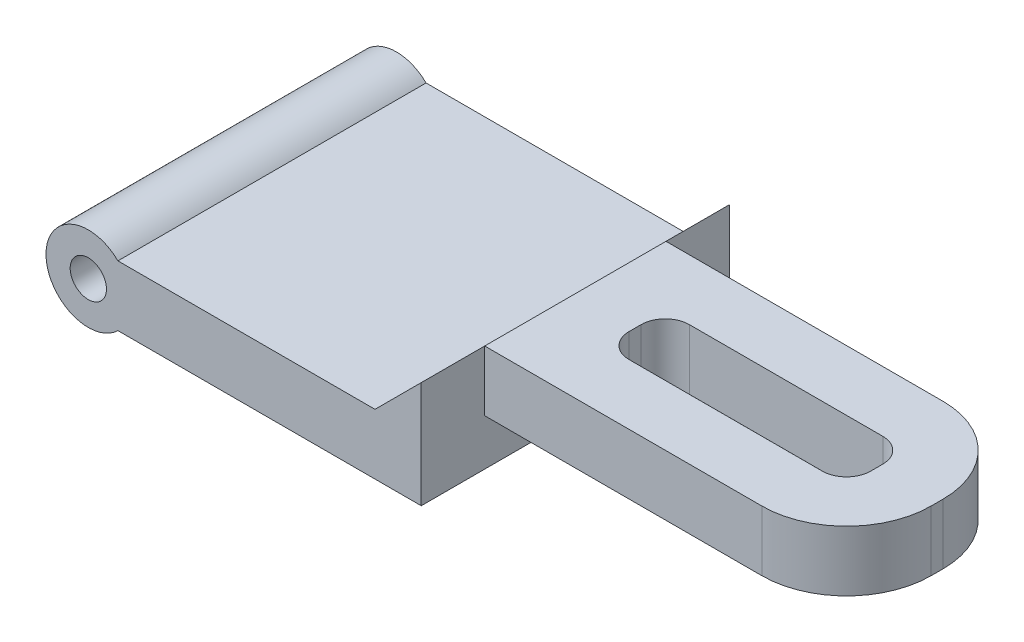
from build123d import *

# Parameters (mm, degrees)
CROQUIS1_W              = 30
CROQUIS1_H              = 25.5
SALIENTE_EXTRUIR1_DEPTH = 5
SALIENTE_EXTRUIR2_DEPTH = 25.5
CROQUIS3_R              = 3.5
SALIENTE_EXTRUIR3_DEPTH = 25.5
CROQUIS4_R              = 1.5
CORTAR_EXTRUIR1_DEPTH   = 31
CORTAR_EXTRUIR2_DEPTH   = 31
CORTAR_EXTRUIR3_DEPTH   = 12


with BuildPart() as part:
    # Croquis1 → Saliente-Extruir1 (new body)
    with BuildSketch(Plane(origin=(0, 0, 0), x_dir=(1, 0, 0), z_dir=(0, 1, 0))):
        with Locations((15, 12.75)):
            Rectangle(CROQUIS1_W, CROQUIS1_H)
    extrude(amount=SALIENTE_EXTRUIR1_DEPTH)

    # Croquis2 → Saliente-Extruir2 (add)
    with BuildSketch(Plane.XY):
        Polygon((26.173467515, 5), (30, 8.826532485), (60, 8.826532485), (60, 3.829826023), (30, 3.829826023), (30, 5), align=None)
    extrude(amount=-SALIENTE_EXTRUIR2_DEPTH)

    # Croquis3 → Saliente-Extruir3 (add)
    with BuildSketch(Plane.XY):
        with Locations((2.449489743, 2.5)):
            Circle(CROQUIS3_R)
    extrude(amount=-SALIENTE_EXTRUIR3_DEPTH)

    # Croquis4 → Cortar-Extruir1 (cut)
    with BuildSketch(Plane.XY):
        with Locations((2.449489743, 2.5)):
            Circle(CROQUIS4_R)
    extrude(amount=-CORTAR_EXTRUIR1_DEPTH, mode=Mode.SUBTRACT)

    # Croquis5 → Cortar-Extruir2 (cut)
    with BuildSketch(Plane.XZ.offset(-3.829826023)):
        with BuildLine():
            Line((52.938565695, -10.25), (36.938565695, -10.25))
            ThreePointArc((36.938565695, -10.25), (35.524352133, -10.835786438), (34.938565695, -12.25))
            Line((34.938565695, -12.25), (34.938565695, -13.25))
            ThreePointArc((34.938565695, -13.25), (35.524352133, -14.664213562), (36.938565695, -15.25))
            Line((36.938565695, -15.25), (52.938565695, -15.25))
            ThreePointArc((52.938565695, -15.25), (54.352779258, -14.664213562), (54.938565695, -13.25))
            Line((54.938565695, -13.25), (54.938565695, -12.25))
            ThreePointArc((54.938565695, -12.25), (54.352779258, -10.835786438), (52.938565695, -10.25))
        make_face()
    extrude(amount=-CORTAR_EXTRUIR2_DEPTH, mode=Mode.SUBTRACT)

    # Croquis6 → Cortar-Extruir3 (cut)
    with BuildSketch(Plane.XZ.offset(-3.829826023)):
        with BuildLine():
            Line((36.938565695, -5.25), (30, -5.25))
            Line((30, -5.25), (30, 0))
            Line((30, 0), (60, 0))
            Line((60, 0), (60, -25.5))
            Line((60, -25.5), (30, -25.5))
            Line((30, -25.5), (30, -20.25))
            Line((30, -20.25), (36.938565695, -20.25))
            Line((36.938565695, -20.25), (52.938565695, -20.25))
            ThreePointArc((52.938565695, -20.25), (57.888313164, -18.199747468), (59.938565695, -13.25))
            Line((59.938565695, -13.25), (59.938565695, -12.25))
            ThreePointArc((59.938565695, -12.25), (57.888313164, -7.300252532), (52.938565695, -5.25))
            Line((52.938565695, -5.25), (36.938565695, -5.25))
        make_face()
    extrude(amount=-CORTAR_EXTRUIR3_DEPTH, mode=Mode.SUBTRACT)


solid = part.part
